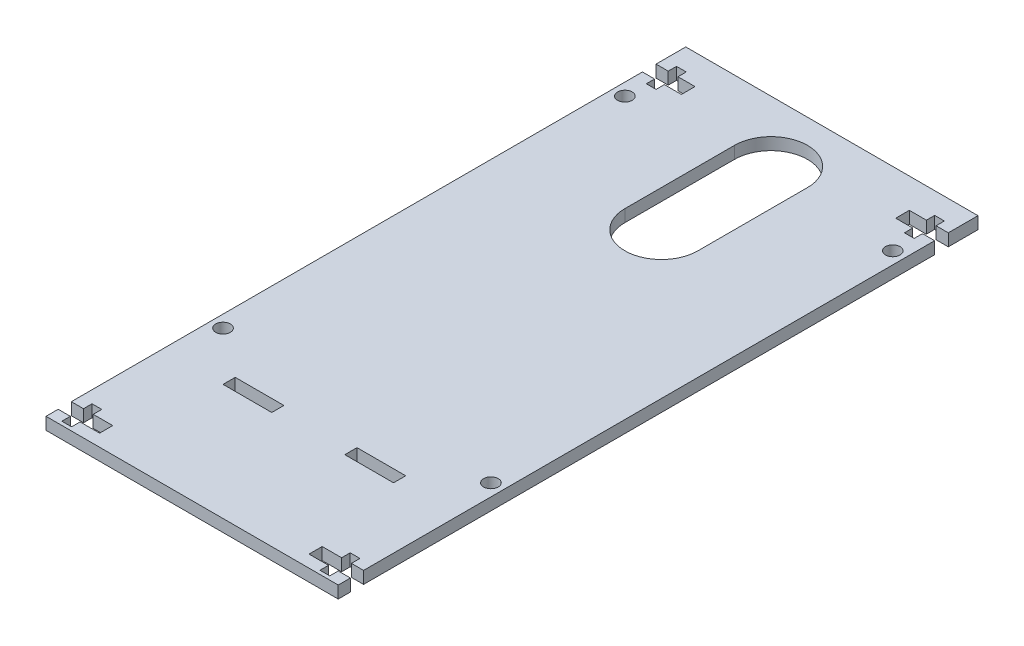
from build123d import *

# Parameters (mm, degrees)
SKETCH1_R           = 1.905
SKETCH1_W           = 12.7
SKETCH1_H           = 3.175
BOSS_EXTRUDE1_DEPTH = 3.175


with BuildPart() as part:
    # Sketch1 → Boss-Extrude1 (new body)
    with BuildSketch(Plane(origin=(0, 0, 0), x_dir=(1, 0, 0), z_dir=(0, 1, 0))):
        Polygon((-38.1, 6.604), (-34.925, 6.604), (-34.925, 8.8265), (-32.385, 8.8265), (-32.385, 6.604), (-27.305, 6.604), (-27.305, 3.175), (-32.385, 3.175), (-32.385, 0.9525), (-34.925, 0.9525), (-34.925, 3.175), (-38.1, 3.175), (-38.1, 0), (0, 0), (38.1, 0), (38.1, 3.175), (34.925, 3.175), (34.925, 0.9525), (32.385, 0.9525), (32.385, 3.175), (27.305, 3.175), (27.305, 6.604), (32.385, 6.604), (32.385, 8.8265), (34.925, 8.8265), (34.925, 6.604), (38.1, 6.604), (38.1, 155.5115), (34.925, 155.5115), (34.925, 153.3525), (32.385, 153.3525), (32.385, 155.5115), (27.94, 155.5115), (27.94, 159.0675), (32.385, 159.0675), (32.385, 161.2265), (34.925, 161.2265), (34.925, 159.0675), (38.1, 159.0675), (38.1, 166.8145), (-38.1, 166.8145), (-38.1, 159.0675), (-34.925, 159.0675), (-34.925, 161.2265), (-32.385, 161.2265), (-32.385, 159.0675), (-27.94, 159.0675), (-27.94, 155.5115), (-32.385, 155.5115), (-32.385, 153.3525), (-34.925, 153.3525), (-34.925, 155.5115), (-38.1, 155.5115), align=None)
        with Locations(Location((-34.925, 42.9895, 0), (0, 0, 270))):
            Circle(SKETCH1_R, mode=Mode.SUBTRACT)
        with Locations(Location((-34.925, 147.7645, 0), (0, 0, 270))):
            Circle(SKETCH1_R, mode=Mode.SUBTRACT)
        with Locations(Location((34.925, 42.9895, 0), (0, 0, 270))):
            Circle(SKETCH1_R, mode=Mode.SUBTRACT)
        with Locations(Location((34.925, 147.7645, 0), (0, 0, 270))):
            Circle(SKETCH1_R, mode=Mode.SUBTRACT)
        with Locations((-15.875, 31.877)):
            Rectangle(SKETCH1_W, SKETCH1_H, mode=Mode.SUBTRACT)
        with Locations((15.875, 31.877)):
            Rectangle(SKETCH1_W, SKETCH1_H, mode=Mode.SUBTRACT)
        with BuildLine():
            Line((9.525, 150.9395), (9.525, 122.3645))
            ThreePointArc((9.525, 122.3645), (0, 112.8395), (-9.525, 122.3645))
            Line((-9.525, 122.3645), (-9.525, 150.9395))
            ThreePointArc((-9.525, 150.9395), (0, 160.4645), (9.525, 150.9395))
        make_face(mode=Mode.SUBTRACT)
    extrude(amount=BOSS_EXTRUDE1_DEPTH)


solid = part.part
